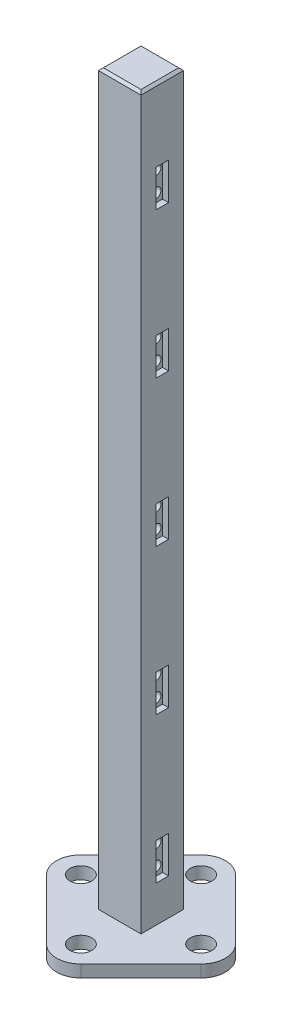
from build123d import *

# Parameters (mm, degrees)
SKETCH1_R             = 4.5
BOSS_EXTRUDE1_DEPTH   = 2.5
SKETCH2_W             = 17.5
SKETCH2_H             = 17.5
BOSS_EXTRUDE2_DEPTH   = 300
SKETCH3_W             = 5.2
SKETCH3_H             = 15.2
CUT_EXTRUDE1_DEPTH    = 2.5
F_4_0MM_DOWEL_HOLE1_D = 4
LPATTERN1_COUNT       = 5
LPATTERN1_PITCH       = 60
CHAMFER1_SIZE         = 1


with BuildPart() as part:
    # Sketch1 → Boss-Extrude1 (new, symmetric)
    with BuildSketch(Plane(origin=(0, 0, 0), x_dir=(1, 0, 0), z_dir=(0, 1, 0))):
        with BuildLine():
            Line((-31.821067812, 7.071067812), (-7.071067812, 31.821067812))
            ThreePointArc((-7.071067812, 31.821067812), (0, 34.75), (7.071067812, 31.821067812))
            Line((7.071067812, 31.821067812), (31.821067812, 7.071067812))
            ThreePointArc((31.821067812, 7.071067812), (34.75, 0), (31.821067812, -7.071067812))
            Line((31.821067812, -7.071067812), (7.071067812, -31.821067812))
            ThreePointArc((7.071067812, -31.821067812), (0, -34.75), (-7.071067812, -31.821067812))
            Line((-7.071067812, -31.821067812), (-31.821067812, -7.071067812))
            ThreePointArc((-31.821067812, -7.071067812), (-34.75, 0), (-31.821067812, 7.071067812))
        make_face()
        with Locations((0, 24.75)):
            Circle(SKETCH1_R, mode=Mode.SUBTRACT)
        with Locations((24.75, 0)):
            Circle(SKETCH1_R, mode=Mode.SUBTRACT)
        with Locations((0, -24.75)):
            Circle(SKETCH1_R, mode=Mode.SUBTRACT)
        with Locations((-24.75, 0)):
            Circle(SKETCH1_R, mode=Mode.SUBTRACT)
    extrude(amount=BOSS_EXTRUDE1_DEPTH, both=True)

    # Sketch2 → Boss-Extrude2 (add)
    with BuildSketch(Plane(origin=(0, 2.5, 0), x_dir=(1, 0, 0), z_dir=(0, 1, 0))):
        Rectangle(SKETCH2_W, SKETCH2_H)
    extrude(amount=BOSS_EXTRUDE2_DEPTH)

    # Sketch3 → Cut-Extrude1 (cut)
    with BuildSketch(Plane(origin=(8.75, 0, 0), x_dir=(0, 0, -1), z_dir=(1, 0, 0))):
        with Locations((0, 25.1)):
            Rectangle(SKETCH3_W, SKETCH3_H)
    cut_extrude1 = extrude(amount=-CUT_EXTRUDE1_DEPTH, mode=Mode.SUBTRACT)

    # Ø4.0mm Dowel Hole1 (through all)
    with Locations(Plane(origin=(6.25, 0, 0), x_dir=(0, 0, -1), z_dir=(1, 0, 0))):
        with Locations((0, 21), (0, 29.2)):
            f_4_0mm_dowel_hole1 = Hole(F_4_0MM_DOWEL_HOLE1_D / 2)

    # LPattern1: Cut-Extrude1, Ø4.0mm Dowel Hole1 ×5
    with Locations(*[(0, i * LPATTERN1_PITCH, 0) for i in range(1, LPATTERN1_COUNT)]):
        add(cut_extrude1, mode=Mode.SUBTRACT)
        add(f_4_0mm_dowel_hole1, mode=Mode.SUBTRACT)

    # Chamfer1
    chamfer1_edges = [part.edges().sort_by_distance(p)[0] for p in [
        (0, 302.5, -8.75),
        (8.75, 302.5, 0),
        (0, 302.5, 8.75),
        (-8.75, 302.5, 0),
    ]]
    chamfer(chamfer1_edges, length=CHAMFER1_SIZE)


solid = part.part
